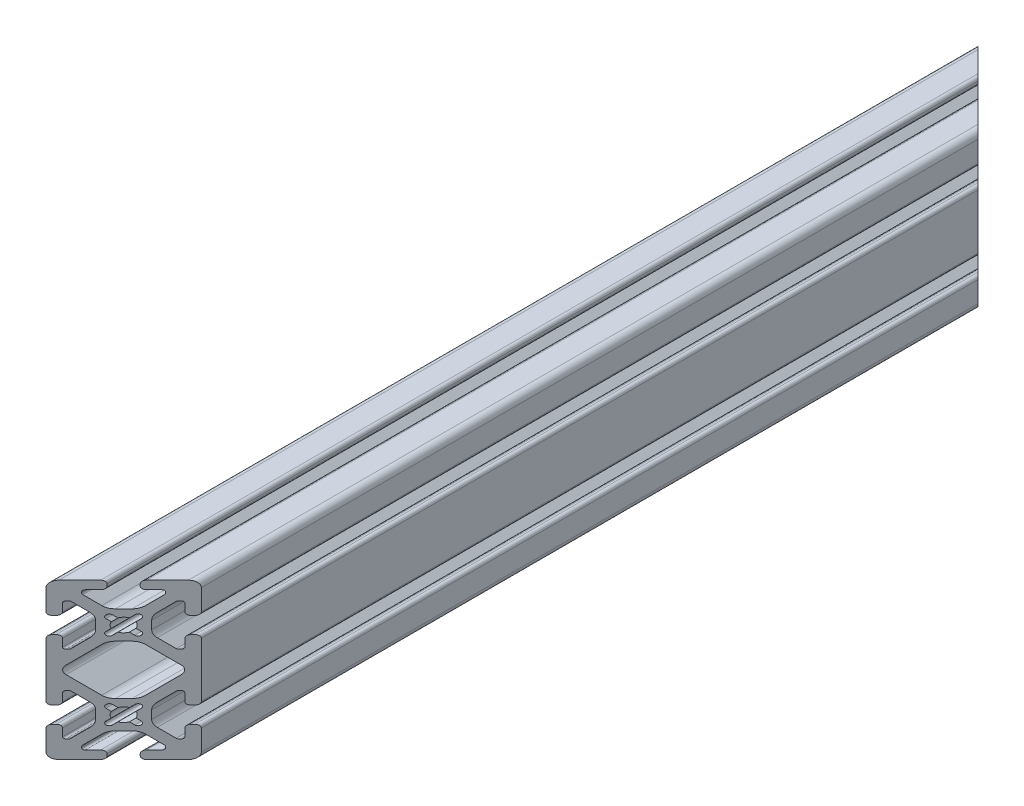
from build123d import *

# Parameters (mm, degrees)
BOSS_EXTRUDE1_DEPTH = 457.2
CUT_EXTRUDE1_REACH  = 440.886


with BuildPart() as part:
    # Sketch1 → Boss-Extrude1 (new body)
    with BuildSketch(Plane(origin=(0, 0, -25.4), x_dir=(-1, 0, 0), z_dir=(0, 0, -1))):
        with BuildLine():
            Line((17.4752, 34.036), (16.5608, 34.036))
            ThreePointArc((16.5608, 34.036), (15.447248241, 33.574751759), (14.986, 32.4612))
            Line((14.986, 32.4612), (14.986, 28.702))
            ThreePointArc((14.986, 28.702), (14.725617928, 28.073382072), (14.097, 27.813))
            Line((14.097, 27.813), (13.528917816, 27.813))
            ThreePointArc((13.528917816, 27.813), (13.188712244, 27.880671096), (12.900299887, 28.073382072))
            Line((12.900299887, 28.073382072), (8.260840398, 32.712841561))
            ThreePointArc((8.260840398, 32.712841561), (7.231213183, 34.253787583), (6.869656187, 36.07145735))
            Line((6.869656187, 36.07145735), (6.869656187, 40.12854265))
            ThreePointArc((6.869656187, 40.12854265), (7.231213183, 41.946212417), (8.260840398, 43.487158439))
            Line((8.260840398, 43.487158439), (12.900299887, 48.126617928))
            ThreePointArc((12.900299887, 48.126617928), (13.188712244, 48.319328904), (13.528917816, 48.387))
            Line((13.528917816, 48.387), (14.097, 48.387))
            ThreePointArc((14.097, 48.387), (14.725617928, 48.126617928), (14.986, 47.498))
            Line((14.986, 47.498), (14.986, 43.7388))
            ThreePointArc((14.986, 43.7388), (15.447248241, 42.625248241), (16.5608, 42.164))
            Line((16.5608, 42.164), (17.4752, 42.164))
            ThreePointArc((17.4752, 42.164), (18.588751759, 42.625248241), (19.05, 43.7388))
            Line((19.05, 43.7388), (19.05, 53.975))
            ThreePointArc((19.05, 53.975), (18.12006403, 56.22006403), (15.875, 57.15))
            Line((15.875, 57.15), (5.6388, 57.15))
            ThreePointArc((5.6388, 57.15), (4.525248241, 56.688751759), (4.064, 55.5752))
            Line((4.064, 55.5752), (4.064, 54.6608))
            ThreePointArc((4.064, 54.6608), (4.525248241, 53.547248241), (5.6388, 53.086))
            Line((5.6388, 53.086), (9.398, 53.086))
            ThreePointArc((9.398, 53.086), (10.026617928, 52.825617928), (10.287, 52.197))
            Line((10.287, 52.197), (10.287, 51.628917816))
            ThreePointArc((10.287, 51.628917816), (10.219328904, 51.288712244), (10.026617928, 51.000299887))
            Line((10.026617928, 51.000299887), (5.387158439, 46.360840398))
            ThreePointArc((5.387158439, 46.360840398), (3.846212417, 45.331213183), (2.02854265, 44.969656187))
            Line((2.02854265, 44.969656187), (-2.02854265, 44.969656187))
            ThreePointArc((-2.02854265, 44.969656187), (-3.846212417, 45.331213183), (-5.387158439, 46.360840398))
            Line((-5.387158439, 46.360840398), (-10.026617928, 51.000299887))
            ThreePointArc((-10.026617928, 51.000299887), (-10.219328904, 51.288712244), (-10.287, 51.628917816))
            Line((-10.287, 51.628917816), (-10.287, 52.197))
            ThreePointArc((-10.287, 52.197), (-10.026617928, 52.825617928), (-9.398, 53.086))
            Line((-9.398, 53.086), (-5.6388, 53.086))
            ThreePointArc((-5.6388, 53.086), (-4.525248241, 53.547248241), (-4.064, 54.6608))
            Line((-4.064, 54.6608), (-4.064, 55.5752))
            ThreePointArc((-4.064, 55.5752), (-4.525248241, 56.688751759), (-5.6388, 57.15))
            Line((-5.6388, 57.15), (-15.875, 57.15))
            ThreePointArc((-15.875, 57.15), (-18.12006403, 56.22006403), (-19.05, 53.975))
            Line((-19.05, 53.975), (-19.05, 43.7388))
            ThreePointArc((-19.05, 43.7388), (-18.588751759, 42.625248241), (-17.4752, 42.164))
            Line((-17.4752, 42.164), (-16.5608, 42.164))
            ThreePointArc((-16.5608, 42.164), (-15.447248241, 42.625248241), (-14.986, 43.7388))
            Line((-14.986, 43.7388), (-14.986, 47.498))
            ThreePointArc((-14.986, 47.498), (-14.725617928, 48.126617928), (-14.097, 48.387))
            Line((-14.097, 48.387), (-13.528917816, 48.387))
            ThreePointArc((-13.528917816, 48.387), (-13.188712244, 48.319328904), (-12.900299887, 48.126617928))
            Line((-12.900299887, 48.126617928), (-8.260840398, 43.487158439))
            ThreePointArc((-8.260840398, 43.487158439), (-7.231213183, 41.946212417), (-6.869656187, 40.12854265))
            Line((-6.869656187, 40.12854265), (-6.869656187, 36.07145735))
            ThreePointArc((-6.869656187, 36.07145735), (-7.231213183, 34.253787583), (-8.260840398, 32.712841561))
            Line((-8.260840398, 32.712841561), (-12.900299887, 28.073382072))
            ThreePointArc((-12.900299887, 28.073382072), (-13.188712244, 27.880671096), (-13.528917816, 27.813))
            Line((-13.528917816, 27.813), (-14.097, 27.813))
            ThreePointArc((-14.097, 27.813), (-14.725617928, 28.073382072), (-14.986, 28.702))
            Line((-14.986, 28.702), (-14.986, 32.4612))
            ThreePointArc((-14.986, 32.4612), (-15.447248241, 33.574751759), (-16.5608, 34.036))
            Line((-16.5608, 34.036), (-17.4752, 34.036))
            ThreePointArc((-17.4752, 34.036), (-18.588751759, 33.574751759), (-19.05, 32.4612))
            Line((-19.05, 32.4612), (-19.05, 5.6388))
            ThreePointArc((-19.05, 5.6388), (-18.588751759, 4.525248241), (-17.4752, 4.064))
            Line((-17.4752, 4.064), (-16.5608, 4.064))
            ThreePointArc((-16.5608, 4.064), (-15.447248241, 4.525248241), (-14.986, 5.6388))
            Line((-14.986, 5.6388), (-14.986, 9.398))
            ThreePointArc((-14.986, 9.398), (-14.725617928, 10.026617928), (-14.097, 10.287))
            Line((-14.097, 10.287), (-13.528917816, 10.287))
            ThreePointArc((-13.528917816, 10.287), (-13.188712244, 10.219328904), (-12.900299887, 10.026617928))
            Line((-12.900299887, 10.026617928), (-8.260840398, 5.387158439))
            ThreePointArc((-8.260840398, 5.387158439), (-7.231213183, 3.846212417), (-6.869656187, 2.02854265))
            Line((-6.869656187, 2.02854265), (-6.869656187, -2.02854265))
            ThreePointArc((-6.869656187, -2.02854265), (-7.231213183, -3.846212417), (-8.260840398, -5.387158439))
            Line((-8.260840398, -5.387158439), (-12.900299887, -10.026617928))
            ThreePointArc((-12.900299887, -10.026617928), (-13.188712244, -10.219328904), (-13.528917816, -10.287))
            Line((-13.528917816, -10.287), (-14.097, -10.287))
            ThreePointArc((-14.097, -10.287), (-14.725617928, -10.026617928), (-14.986, -9.398))
            Line((-14.986, -9.398), (-14.986, -5.6388))
            ThreePointArc((-14.986, -5.6388), (-15.447248241, -4.525248241), (-16.5608, -4.064))
            Line((-16.5608, -4.064), (-17.4752, -4.064))
            ThreePointArc((-17.4752, -4.064), (-18.588751759, -4.525248241), (-19.05, -5.6388))
            Line((-19.05, -5.6388), (-19.05, -15.875))
            ThreePointArc((-19.05, -15.875), (-18.12006403, -18.12006403), (-15.875, -19.05))
            Line((-15.875, -19.05), (-5.6388, -19.05))
            ThreePointArc((-5.6388, -19.05), (-4.525248241, -18.588751759), (-4.064, -17.4752))
            Line((-4.064, -17.4752), (-4.064, -16.5608))
            ThreePointArc((-4.064, -16.5608), (-4.525248241, -15.447248241), (-5.6388, -14.986))
            Line((-5.6388, -14.986), (-9.398, -14.986))
            ThreePointArc((-9.398, -14.986), (-10.026617928, -14.725617928), (-10.287, -14.097))
            Line((-10.287, -14.097), (-10.287, -13.528917816))
            ThreePointArc((-10.287, -13.528917816), (-10.219328904, -13.188712244), (-10.026617928, -12.900299887))
            Line((-10.026617928, -12.900299887), (-5.387158439, -8.260840398))
            ThreePointArc((-5.387158439, -8.260840398), (-3.846212417, -7.231213183), (-2.02854265, -6.869656187))
            Line((-2.02854265, -6.869656187), (2.02854265, -6.869656187))
            ThreePointArc((2.02854265, -6.869656187), (3.846212417, -7.231213183), (5.387158439, -8.260840398))
            Line((5.387158439, -8.260840398), (10.026617928, -12.900299887))
            ThreePointArc((10.026617928, -12.900299887), (10.219328904, -13.188712244), (10.287, -13.528917816))
            Line((10.287, -13.528917816), (10.287, -14.097))
            ThreePointArc((10.287, -14.097), (10.026617928, -14.725617928), (9.398, -14.986))
            Line((9.398, -14.986), (5.6388, -14.986))
            ThreePointArc((5.6388, -14.986), (4.525248241, -15.447248241), (4.064, -16.5608))
            Line((4.064, -16.5608), (4.064, -17.4752))
            ThreePointArc((4.064, -17.4752), (4.525248241, -18.588751759), (5.6388, -19.05))
            Line((5.6388, -19.05), (15.875, -19.05))
            ThreePointArc((15.875, -19.05), (18.12006403, -18.12006403), (19.05, -15.875))
            Line((19.05, -15.875), (19.05, -5.6388))
            ThreePointArc((19.05, -5.6388), (18.588751759, -4.525248241), (17.4752, -4.064))
            Line((17.4752, -4.064), (16.5608, -4.064))
            ThreePointArc((16.5608, -4.064), (15.447248241, -4.525248241), (14.986, -5.6388))
            Line((14.986, -5.6388), (14.986, -9.398))
            ThreePointArc((14.986, -9.398), (14.725617928, -10.026617928), (14.097, -10.287))
            Line((14.097, -10.287), (13.528917816, -10.287))
            ThreePointArc((13.528917816, -10.287), (13.188712244, -10.219328904), (12.900299887, -10.026617928))
            Line((12.900299887, -10.026617928), (8.260840398, -5.387158439))
            ThreePointArc((8.260840398, -5.387158439), (7.231213183, -3.846212417), (6.869656187, -2.02854265))
            Line((6.869656187, -2.02854265), (6.869656187, 2.02854265))
            ThreePointArc((6.869656187, 2.02854265), (7.231213183, 3.846212417), (8.260840398, 5.387158439))
            Line((8.260840398, 5.387158439), (12.900299887, 10.026617928))
            ThreePointArc((12.900299887, 10.026617928), (13.188712244, 10.219328904), (13.528917816, 10.287))
            Line((13.528917816, 10.287), (14.097, 10.287))
            ThreePointArc((14.097, 10.287), (14.725617928, 10.026617928), (14.986, 9.398))
            Line((14.986, 9.398), (14.986, 5.6388))
            ThreePointArc((14.986, 5.6388), (15.447248241, 4.525248241), (16.5608, 4.064))
            Line((16.5608, 4.064), (17.4752, 4.064))
            ThreePointArc((17.4752, 4.064), (18.588751759, 4.525248241), (19.05, 5.6388))
            Line((19.05, 5.6388), (19.05, 32.4612))
            ThreePointArc((19.05, 32.4612), (18.588751759, 33.574751759), (17.4752, 34.036))
        make_face()
        with BuildLine():
            Line((5.387158439, 29.839159602), (14.110859133, 21.115458908))
            ThreePointArc((14.110859133, 21.115458908), (14.966400226, 19.05), (14.110859133, 16.984541092))
            Line((14.110859133, 16.984541092), (5.387158439, 8.260840398))
            ThreePointArc((5.387158439, 8.260840398), (3.846212417, 7.231213183), (2.02854265, 6.869656187))
            Line((2.02854265, 6.869656187), (-2.02854265, 6.869656187))
            ThreePointArc((-2.02854265, 6.869656187), (-3.846212417, 7.231213183), (-5.387158439, 8.260840398))
            Line((-5.387158439, 8.260840398), (-14.110859133, 16.984541092))
            ThreePointArc((-14.110859133, 16.984541092), (-14.966400226, 19.05), (-14.110859133, 21.115458908))
            Line((-14.110859133, 21.115458908), (-5.387158439, 29.839159602))
            ThreePointArc((-5.387158439, 29.839159602), (-3.846212417, 30.868786817), (-2.02854265, 31.230343813))
            Line((-2.02854265, 31.230343813), (2.02854265, 31.230343813))
            ThreePointArc((2.02854265, 31.230343813), (3.846212417, 30.868786817), (5.387158439, 29.839159602))
        make_face(mode=Mode.SUBTRACT)
        with BuildLine():
            Line((1.401430967, 3.017877069), (2.72685484, 4.343300942))
            ThreePointArc((2.72685484, 4.343300942), (4.343300937, 4.343300943), (4.34330094, 2.726854846))
            Line((4.34330094, 2.726854846), (3.017877069, 1.401430967))
            ThreePointArc((3.017877069, 1.401430967), (3.3274, 9e-09), (3.017877077, -1.40143095))
            Line((3.017877077, -1.40143095), (4.343300961, -2.726854828))
            ThreePointArc((4.343300961, -2.726854828), (4.343300966, -4.343300942), (2.726854852, -4.343300946))
            Line((2.726854852, -4.343300946), (1.401430967, -3.017877069))
            ThreePointArc((1.401430967, -3.017877069), (9e-09, -3.3274), (-1.40143095, -3.017877077))
            Line((-1.40143095, -3.017877077), (-2.726854834, -4.343300967))
            ThreePointArc((-2.726854834, -4.343300967), (-4.343300953, -4.343300971), (-4.343300954, -2.726854852))
            Line((-4.343300954, -2.726854852), (-3.017877069, -1.401430967))
            ThreePointArc((-3.017877069, -1.401430967), (-3.3274, -9e-09), (-3.017877077, 1.40143095))
            Line((-3.017877077, 1.40143095), (-4.343300961, 2.726854828))
            ThreePointArc((-4.343300961, 2.726854828), (-4.343300966, 4.343300942), (-2.726854852, 4.343300946))
            Line((-2.726854852, 4.343300946), (-1.401430967, 3.017877069))
            ThreePointArc((-1.401430967, 3.017877069), (0, 3.3274), (1.401430967, 3.017877069))
        make_face(mode=Mode.SUBTRACT)
        with BuildLine():
            Line((3.017877073, 36.698569024), (4.343300948, 35.373145156))
            ThreePointArc((4.343300948, 35.373145156), (4.343300954, 33.756699073), (2.726854871, 33.756699063))
            Line((2.726854871, 33.756699063), (1.401430985, 35.082122929))
            ThreePointArc((1.401430985, 35.082122929), (2.9e-08, 34.772599992), (-1.401430933, 35.082122908))
            Line((-1.401430933, 35.082122908), (-2.726854762, 33.756699066))
            ThreePointArc((-2.726854762, 33.756699066), (-4.343300901, 33.75669906), (-4.343300903, 35.373145199))
            Line((-4.343300903, 35.373145199), (-3.017877069, 36.698569033))
            ThreePointArc((-3.017877069, 36.698569033), (-3.327399996, 38.099999979), (-3.017877079, 39.501430928))
            Line((-3.017877079, 39.501430928), (-4.343300948, 40.826854777))
            ThreePointArc((-4.343300948, 40.826854777), (-4.343300957, 42.443300899), (-2.726854835, 42.443300905))
            Line((-2.726854835, 42.443300905), (-1.401430977, 41.117877054))
            ThreePointArc((-1.401430977, 41.117877054), (-8e-09, 41.427399992), (1.401430963, 41.117877065))
            Line((1.401430963, 41.117877065), (2.726854864, 42.443300966))
            ThreePointArc((2.726854864, 42.443300966), (4.343300963, 42.443300968), (4.343300969, 40.826854869))
            Line((4.343300969, 40.826854869), (3.017877073, 39.501430959))
            ThreePointArc((3.017877073, 39.501430959), (3.327400004, 38.099999992), (3.017877073, 36.698569024))
        make_face(mode=Mode.SUBTRACT)
    extrude(amount=-BOSS_EXTRUDE1_DEPTH)

    # Sketch2 → Cut-Extrude1 (cut, up to next)
    with BuildSketch(Plane.XZ.offset(19.05), mode=Mode.PRIVATE) as cut_extrude1_sk1:
        Polygon((-19.05, -25.4), (19.05, 12.7), (19.05, -25.4), align=None)
    cut_extrude1_tool1 = extrude(cut_extrude1_sk1.sketch, amount=-CUT_EXTRUDE1_REACH, mode=Mode.PRIVATE) & part.part
    # Sketch2 → Cut-Extrude1 (cut, up to next)
    with BuildSketch(Plane.XZ.offset(19.05), mode=Mode.PRIVATE) as cut_extrude1_sk2:
        Polygon((19.05, 393.7), (-19.05, 431.8), (19.05, 431.8), align=None)
    cut_extrude1_tool2 = extrude(cut_extrude1_sk2.sketch, amount=-CUT_EXTRUDE1_REACH, mode=Mode.PRIVATE) & part.part
    add(cut_extrude1_tool1.solids().sort_by_distance((6.35, -19.05, -12.7))[0], mode=Mode.SUBTRACT)
    add(cut_extrude1_tool2.solids().sort_by_distance((6.35, -19.05, 419.1))[0], mode=Mode.SUBTRACT)


solid = part.part
